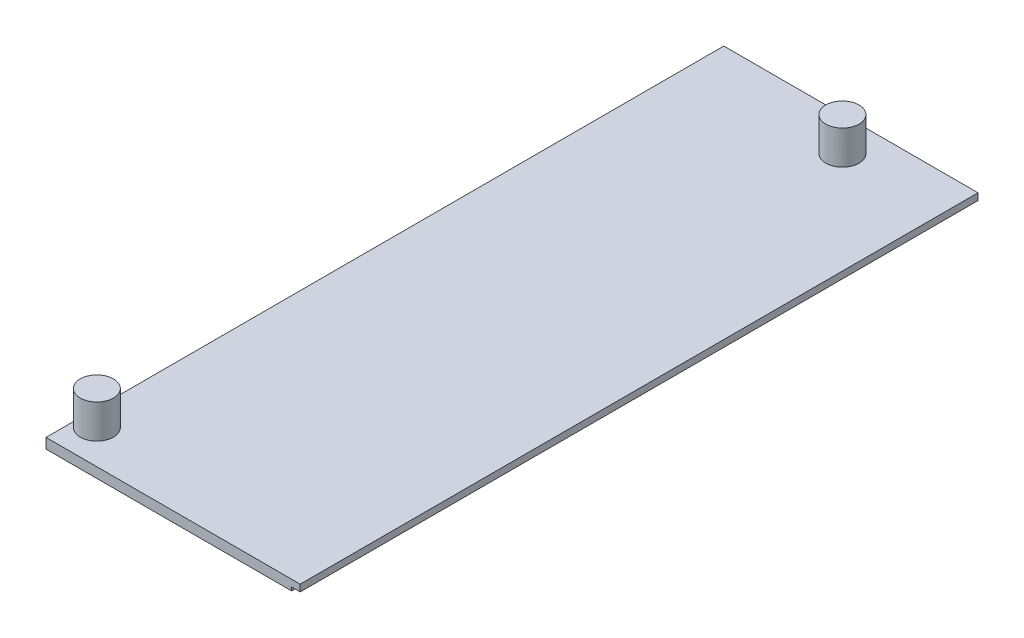
from build123d import *

# Parameters (mm, degrees)
SKETCH1_W           = 75
SKETCH1_H           = 3
BOSS_EXTRUDE1_DEPTH = 200
SKETCH2_R           = 4.9
BOSS_EXTRUDE2_DEPTH = 10
SKETCH3_W           = 2.5
SKETCH3_H           = 200
CUT_EXTRUDE1_DEPTH  = 1


with BuildPart() as part:
    # Sketch1 → Boss-Extrude1 (new body)
    with BuildSketch(Plane.XY):
        with Locations((37.5, 1.5)):
            Rectangle(SKETCH1_W, SKETCH1_H)
    extrude(amount=BOSS_EXTRUDE1_DEPTH)

    # Sketch2 → Boss-Extrude2 (add)
    with BuildSketch(Plane(origin=(0, 3, 0), x_dir=(1, 0, 0), z_dir=(0, 1, 0))):
        with Locations(Location((45, -10, 0), (0, 0, 90))):
            Circle(SKETCH2_R)
        with Locations(Location((5, -190, 0), (0, 0, 90))):
            Circle(SKETCH2_R)
    extrude(amount=BOSS_EXTRUDE2_DEPTH)

    # Sketch3 → Cut-Extrude1 (cut)
    with BuildSketch(Plane.XZ):
        with Locations((73.75, 100)):
            Rectangle(SKETCH3_W, SKETCH3_H)
    extrude(amount=-CUT_EXTRUDE1_DEPTH, mode=Mode.SUBTRACT)


solid = part.part
